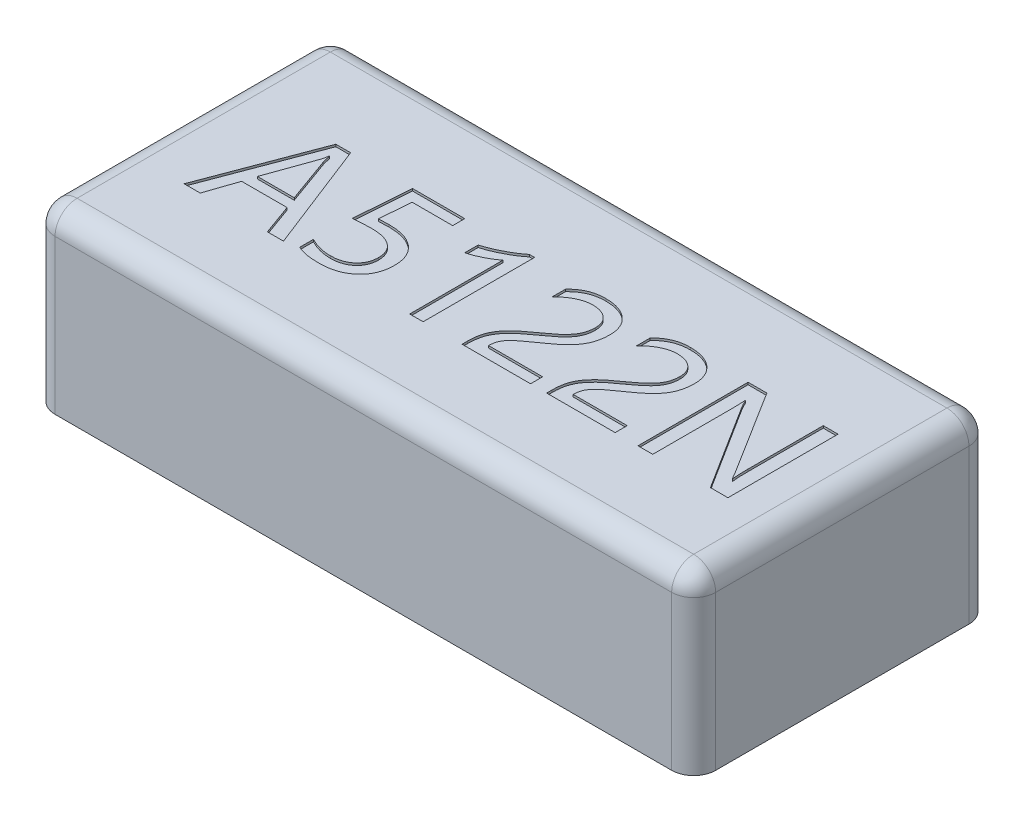
from build123d import *

# Parameters (mm, degrees)
SKETCH_1_W          = 3
SKETCH_1_H          = 1.35
EXTRUDE_1_DEPTH     = 0.8
CUT_EXTRUDE_1_DEPTH = 0.01
FILLET_1_R          = 0.1


with BuildPart() as part:
    # 草图1 → 凸台-拉伸1 (new body)
    with BuildSketch(Plane(origin=(0, 0, 0), x_dir=(1, 0, 0), z_dir=(0, 1, 0))):
        Rectangle(SKETCH_1_W, SKETCH_1_H)
    extrude(amount=EXTRUDE_1_DEPTH)

    # 草图2 → 切除-拉伸1 (cut)
    # profile 1 of 6: a face of its own
    with BuildSketch(Plane(origin=(0, 0.8, 0), x_dir=(1, 0, 0), z_dir=(0, 1, 0))):
        Polygon((-0.762682927, -0.275), (-0.835853659, -0.275), (-0.88644436, -0.134756098), (-1.092999238, -0.134756098), (-1.140731707, -0.275), (-1.213902439, -0.275), (-1.024878049, 0.225), (-0.957804878, 0.225), align=None)
        with BuildLine():
            Line((-0.908929116, -0.079878049), (-0.984195884, 0.128963415))
            add(Edge.make_bspline(
                [(-0.984195884, 0.128963415), (-0.984819837, 0.130958332), (-0.98624412, 0.135512088), (-0.988110524, 0.143371617), (-0.989940416, 0.153088443), (-0.991219762, 0.160180703), (-0.99191311, 0.16402439)],
                knots=[0, 0, 0, 0, 0.697926861, 1.593143037, 2.69559139, 4, 4, 4, 4], degree=3))
            Line((-0.99191311, 0.16402439), (-0.993532774, 0.16402439))
            add(Edge.make_bspline(
                [(-0.993532774, 0.16402439), (-0.994115816, 0.160463944), (-0.995217229, 0.153737965), (-0.997076473, 0.144313477), (-0.999146543, 0.136168571), (-1.000780111, 0.131242354), (-1.001535823, 0.128963415)],
                knots=[0, 0, 0, 0, 1.202164453, 2.270988586, 3.200134455, 4, 4, 4, 4], degree=3))
            Line((-1.001535823, 0.128963415), (-1.076135671, -0.079878049))
            Line((-1.076135671, -0.079878049), (-0.908929116, -0.079878049))
        make_face(mode=Mode.SUBTRACT)
    # profile 2 of 6: a face of its own
    with BuildSketch(Plane(origin=(0, 0.8, 0), x_dir=(1, 0, 0), z_dir=(0, 1, 0))):
        with BuildLine():
            add(Edge.make_bspline(
                [(-0.415121951, -0.119321646), (-0.415260902, -0.12523666), (-0.415533167, -0.136826739), (-0.417887924, -0.153767891), (-0.421638413, -0.169887983), (-0.427129507, -0.185060805), (-0.433988028, -0.199430346), (-0.442572039, -0.212776961), (-0.452492586, -0.225388943), (-0.464052036, -0.236834997), (-0.476798193, -0.247236482), (-0.490700249, -0.256310478), (-0.505598386, -0.264098094), (-0.521670586, -0.27027152), (-0.53873972, -0.275100097), (-0.556865546, -0.278637204), (-0.57602153, -0.280752417), (-0.589151083, -0.28098087), (-0.59585747, -0.281097561)],
                knots=[0, 0, 0, 0, 1.038164429, 2.034214658, 2.997233558, 3.939129121, 4.861930507, 5.787020473, 6.719742937, 7.673971107, 8.63719987, 9.603860661, 10.584050106, 11.583357422, 12.62125224, 13.695192892, 14.822737847, 16, 16, 16, 16], degree=3))
            add(Edge.make_bspline(
                [(-0.59585747, -0.281097561), (-0.601575406, -0.281054569), (-0.612670493, -0.280971146), (-0.62872232, -0.279994611), (-0.643663296, -0.278482416), (-0.657483785, -0.276450727), (-0.670177479, -0.273683171), (-0.681780763, -0.27036605), (-0.692282069, -0.26646385), (-0.698655053, -0.263152325), (-0.701707317, -0.261566311)],
                knots=[0, 0, 0, 0, 1.262385657, 2.449533769, 3.549188029, 4.577605264, 5.532151448, 6.415420393, 7.241084701, 8, 8, 8, 8], degree=3))
            Line((-0.701707317, -0.261566311), (-0.701707317, -0.200304878))
            add(Edge.make_bspline(
                [(-0.701707317, -0.200304878), (-0.697509039, -0.20239354), (-0.689190683, -0.206531958), (-0.676386069, -0.21169761), (-0.663604416, -0.216256725), (-0.650697436, -0.219841452), (-0.637763189, -0.222743267), (-0.624739759, -0.224705419), (-0.611668722, -0.226027811), (-0.602911029, -0.226155544), (-0.598525152, -0.226219512)],
                knots=[0, 0, 0, 0, 1.047486704, 2.075462357, 3.083249586, 4.078565337, 5.066949607, 6.043568961, 7.0202141, 8, 8, 8, 8], degree=3))
            add(Edge.make_bspline(
                [(-0.598525152, -0.226219512), (-0.594266917, -0.226114915), (-0.585954623, -0.225910735), (-0.573806645, -0.224702562), (-0.56228904, -0.222521759), (-0.551444415, -0.219341561), (-0.541132686, -0.215463568), (-0.531505843, -0.210580233), (-0.522495941, -0.204847636), (-0.514207141, -0.198257821), (-0.506692759, -0.190984798), (-0.500169614, -0.183004319), (-0.494609732, -0.174476512), (-0.489998836, -0.165387739), (-0.486453177, -0.155695759), (-0.484021656, -0.145427152), (-0.482425125, -0.134615588), (-0.482272873, -0.127203558), (-0.482195122, -0.123418445)],
                knots=[0, 0, 0, 0, 1.169775658, 2.283461802, 3.349348441, 4.384667205, 5.38427129, 6.371310876, 7.344138773, 8.31281178, 9.275179281, 10.21120959, 11.137925121, 12.066445516, 13.004790073, 13.965376693, 14.960975861, 16, 16, 16, 16], degree=3))
            add(Edge.make_bspline(
                [(-0.482195122, -0.123418445), (-0.482262482, -0.119631925), (-0.482393909, -0.112243979), (-0.484117988, -0.101531648), (-0.486619826, -0.091396463), (-0.490374159, -0.08198613), (-0.495068695, -0.073143415), (-0.500971484, -0.065070634), (-0.507711465, -0.057427834), (-0.515727897, -0.050712732), (-0.524545098, -0.044614168), (-0.534295824, -0.039337225), (-0.544858385, -0.034879063), (-0.556317161, -0.03126407), (-0.568608732, -0.028400605), (-0.581803478, -0.026468727), (-0.595831591, -0.02517393), (-0.60547706, -0.025059046), (-0.610434451, -0.025)],
                knots=[0, 0, 0, 0, 0.99272704, 1.936926984, 2.840561303, 3.727434335, 4.588876569, 5.460898877, 6.346203886, 7.256578408, 8.197535443, 9.156084033, 10.160775423, 11.20196967, 12.305862844, 13.469319152, 14.699329797, 16, 16, 16, 16], degree=3))
            add(Edge.make_bspline(
                [(-0.610434451, -0.025), (-0.618120539, -0.025060319), (-0.633083703, -0.025177747), (-0.654974106, -0.02593133), (-0.675690722, -0.027230365), (-0.689102517, -0.028551214), (-0.695609756, -0.029192073)],
                knots=[0, 0, 0, 0, 1.081060347, 2.104592606, 3.080371503, 4, 4, 4, 4], degree=3))
            Line((-0.695609756, -0.029192073), (-0.676935976, 0.225))
            Line((-0.676935976, 0.225), (-0.439512195, 0.225))
            Line((-0.439512195, 0.225), (-0.439512195, 0.170121951))
            Line((-0.439512195, 0.170121951), (-0.624058689, 0.170121951))
            Line((-0.624058689, 0.170121951), (-0.634634146, 0.027972561))
            Line((-0.634634146, 0.027972561), (-0.588330793, 0.029878049))
            add(Edge.make_bspline(
                [(-0.588330793, 0.029878049), (-0.581751376, 0.029793109), (-0.56894406, 0.029627767), (-0.550325441, 0.027632461), (-0.532764038, 0.024636841), (-0.516271992, 0.0203757), (-0.500844703, 0.014868525), (-0.486581812, 0.00804022), (-0.473289788, 0.000141922), (-0.461244435, -0.009135445), (-0.450280795, -0.01936476), (-0.440966724, -0.030839481), (-0.432811804, -0.043073859), (-0.426336299, -0.056462802), (-0.421292946, -0.07081891), (-0.417662639, -0.086142271), (-0.415585268, -0.102432782), (-0.415278934, -0.113599286), (-0.415121951, -0.119321646)],
                knots=[0, 0, 0, 0, 1.218679116, 2.372248176, 3.465519652, 4.517479775, 5.524548886, 6.495855075, 7.443537969, 8.383975825, 9.308106099, 10.215311382, 11.116292035, 12.026926498, 12.963138392, 13.930908325, 14.939678235, 16, 16, 16, 16], degree=3))
        make_face()
    # profile 3 of 6: a face of its own
    with BuildSketch(Plane(origin=(0, 0.8, 0), x_dir=(1, 0, 0), z_dir=(0, 1, 0))):
        with BuildLine():
            Line((-0.189512195, -0.275), (-0.189512195, 0.149733232))
            add(Edge.make_bspline(
                [(-0.189512195, 0.149733232), (-0.192346519, 0.14712321), (-0.198588169, 0.14137551), (-0.210149791, 0.133606387), (-0.223947541, 0.124935408), (-0.239939412, 0.116417664), (-0.256729311, 0.10805238), (-0.273528408, 0.101103717), (-0.289536436, 0.095074127), (-0.30019508, 0.0922323), (-0.305365854, 0.090853659)],
                knots=[0, 0, 0, 0, 0.704945565, 1.552406624, 2.545318557, 3.69082532, 4.869537831, 5.980344412, 7.020214797, 8, 8, 8, 8], degree=3))
            Line((-0.305365854, 0.090853659), (-0.305365854, 0.151829268))
            add(Edge.make_bspline(
                [(-0.305365854, 0.151829268), (-0.298631014, 0.153793347), (-0.284809115, 0.157824223), (-0.264160875, 0.165990134), (-0.242663796, 0.175200882), (-0.221212827, 0.186134718), (-0.200625716, 0.197470264), (-0.182063996, 0.208807994), (-0.166043289, 0.219751609), (-0.156657746, 0.227477429), (-0.152259909, 0.231097561)],
                knots=[0, 0, 0, 0, 0.96993373, 1.990593425, 3.068734014, 4.204309626, 5.319269746, 6.319096776, 7.212369491, 8, 8, 8, 8], degree=3))
            Line((-0.152259909, 0.231097561), (-0.128536585, 0.231097561))
            Line((-0.128536585, 0.231097561), (-0.128536585, -0.275))
            Line((-0.128536585, -0.275), (-0.189512195, -0.275))
        make_face()
    # profile 4 of 6: a face of its own
    with BuildSketch(Plane(origin=(0, 0.8, 0), x_dir=(1, 0, 0), z_dir=(0, 1, 0))):
        with BuildLine():
            add(Edge.make_bspline(
                [(0.286097561, 0.092282774), (0.286037108, 0.095463368), (0.285918736, 0.101691249), (0.28462195, 0.110744613), (0.282682168, 0.119295031), (0.279761029, 0.12725745), (0.276150535, 0.134766761), (0.27164437, 0.141719481), (0.266377784, 0.148184135), (0.260235673, 0.153962471), (0.253477506, 0.159203928), (0.24612347, 0.163811235), (0.238144734, 0.167614569), (0.22962738, 0.170755423), (0.22052128, 0.17327107), (0.210814324, 0.174909842), (0.200534072, 0.176001632), (0.193493865, 0.176145478), (0.189870427, 0.176219512)],
                knots=[0, 0, 0, 0, 1.056493516, 2.068706555, 3.034034235, 3.965700842, 4.881624935, 5.798157171, 6.713229185, 7.646568874, 8.594657173, 9.55250989, 10.525140525, 11.527173638, 12.566921247, 13.660321224, 14.795819181, 16, 16, 16, 16], degree=3))
            add(Edge.make_bspline(
                [(0.189870427, 0.176219512), (0.184616762, 0.176039497), (0.173996066, 0.175675581), (0.158069922, 0.172551806), (0.142065962, 0.16756762), (0.126150901, 0.160563739), (0.110403467, 0.151898546), (0.095136208, 0.141455531), (0.08036348, 0.129310796), (0.071239984, 0.120122254), (0.066585366, 0.115434451)],
                knots=[0, 0, 0, 0, 0.892438729, 1.804135133, 2.748433758, 3.73736023, 4.75466059, 5.799871438, 6.877540064, 8, 8, 8, 8], degree=3))
            Line((0.066585366, 0.115434451), (0.066585366, 0.17660061))
            add(Edge.make_bspline(
                [(0.066585366, 0.17660061), (0.070769002, 0.180805496), (0.07904729, 0.189125832), (0.092603047, 0.200156156), (0.1071503, 0.209408862), (0.122490072, 0.217354479), (0.138997503, 0.223606342), (0.15681926, 0.227935202), (0.175938928, 0.23067075), (0.189162004, 0.230952528), (0.195967988, 0.231097561)],
                knots=[0, 0, 0, 0, 0.983052709, 1.945195957, 2.890199405, 3.836873689, 4.805049423, 5.808824637, 6.872191052, 8, 8, 8, 8], degree=3))
            add(Edge.make_bspline(
                [(0.195967988, 0.231097561), (0.201499169, 0.230995753), (0.212335004, 0.230796307), (0.228154002, 0.229003513), (0.243198533, 0.226346932), (0.257325158, 0.222274315), (0.270707857, 0.217264487), (0.283179808, 0.210926705), (0.294898473, 0.203584012), (0.305646308, 0.195102514), (0.315355283, 0.185688305), (0.32393213, 0.175457525), (0.331104645, 0.164339631), (0.33692842, 0.152425522), (0.341559639, 0.139761646), (0.344758841, 0.126268084), (0.34669202, 0.111965417), (0.346943992, 0.102165775), (0.347073171, 0.097141768)],
                knots=[0, 0, 0, 0, 1.165659335, 2.283579358, 3.352509362, 4.382528111, 5.378518292, 6.360617159, 7.326516104, 8.289556701, 9.241242913, 10.173056761, 11.097893164, 12.023117237, 12.96350264, 13.934585421, 14.941118791, 16, 16, 16, 16], degree=3))
            add(Edge.make_bspline(
                [(0.347073171, 0.097141768), (0.347012737, 0.092628655), (0.346893336, 0.083711887), (0.345566227, 0.070613406), (0.343723241, 0.057930926), (0.340961669, 0.045728025), (0.337320342, 0.033990744), (0.332937578, 0.02271412), (0.327779579, 0.011917363), (0.321802722, 0.001495633), (0.314834232, -0.008706588), (0.306830072, -0.018906808), (0.297611735, -0.029070104), (0.287395012, -0.039425599), (0.275968592, -0.049745769), (0.263433793, -0.060113054), (0.249913676, -0.070679642), (0.240272886, -0.077383942), (0.235316311, -0.080830793)],
                knots=[0, 0, 0, 0, 0.982770191, 1.941704783, 2.86532617, 3.773295145, 4.663914152, 5.540094637, 6.406524984, 7.268052773, 8.154551202, 9.09565156, 10.090161433, 11.141928465, 12.263462189, 13.442437348, 14.685092139, 16, 16, 16, 16], degree=3))
            add(Edge.make_bspline(
                [(0.235316311, -0.080830793), (0.230321866, -0.084280407), (0.220716138, -0.09091499), (0.207067603, -0.100625895), (0.194650401, -0.10947442), (0.183544449, -0.117577001), (0.173790909, -0.125025081), (0.16518635, -0.13155201), (0.157933782, -0.137354734), (0.150199576, -0.143939067), (0.142123251, -0.151610714), (0.133857616, -0.160626609), (0.127200543, -0.169504376), (0.12205617, -0.178379998), (0.118361419, -0.187669224), (0.115662814, -0.197630819), (0.114194231, -0.20858234), (0.113961974, -0.216179859), (0.113841463, -0.220121951)],
                knots=[0, 0, 0, 0, 1.505881014, 2.896234166, 4.155602516, 5.288659075, 6.306624478, 7.200142241, 7.96796157, 8.610611676, 9.719635667, 10.729273515, 11.641662871, 12.467445708, 13.266290447, 14.114874402, 15.021872832, 16, 16, 16, 16], degree=3))
            Line((0.113841463, -0.220121951), (0.359268293, -0.220121951))
            Line((0.359268293, -0.220121951), (0.359268293, -0.275))
            Line((0.359268293, -0.275), (0.048292683, -0.275))
            Line((0.048292683, -0.275), (0.048292683, -0.250228659))
            add(Edge.make_bspline(
                [(0.048292683, -0.250228659), (0.048438829, -0.243331582), (0.048721135, -0.230008645), (0.050876321, -0.210832743), (0.054575045, -0.193281147), (0.059752232, -0.177109003), (0.066831981, -0.161893424), (0.075749465, -0.1471639), (0.086493429, -0.132557454), (0.097087265, -0.120814422), (0.106560022, -0.111111912), (0.114907478, -0.103577592), (0.124054991, -0.095497593), (0.134262682, -0.0871993), (0.145291811, -0.078393143), (0.157352873, -0.069335356), (0.170379333, -0.059951814), (0.179415318, -0.053604643), (0.184058689, -0.050342988)],
                knots=[0, 0, 0, 0, 1.301735404, 2.514534667, 3.636202092, 4.682652211, 5.712626133, 6.796226652, 7.928068212, 9.129839025, 9.778404403, 10.486922114, 11.251617588, 12.082117295, 12.969658096, 13.915626098, 14.928891403, 16, 16, 16, 16], degree=3))
            add(Edge.make_bspline(
                [(0.184058689, -0.050342988), (0.18881472, -0.047009549), (0.198008011, -0.040566094), (0.210937368, -0.030695385), (0.222846954, -0.021305233), (0.23342433, -0.012073149), (0.242993382, -0.003306745), (0.251240737, 0.005268447), (0.258456049, 0.013455909), (0.264574574, 0.021456347), (0.269702837, 0.029506336), (0.274081285, 0.037700277), (0.277822451, 0.046132235), (0.280915994, 0.05481301), (0.283136821, 0.063829949), (0.284923032, 0.073072564), (0.285826313, 0.082610578), (0.286006676, 0.089041992), (0.286097561, 0.092282774)],
                knots=[0, 0, 0, 0, 1.519141936, 2.93646385, 4.254680188, 5.48560532, 6.608384985, 7.648317938, 8.596314735, 9.461999189, 10.280135729, 11.09038868, 11.890052435, 12.691440534, 13.497423121, 14.317034656, 15.151955661, 16, 16, 16, 16], degree=3))
        make_face()
    # profile 5 of 6: a face of its own
    with BuildSketch(Plane(origin=(0, 0.8, 0), x_dir=(1, 0, 0), z_dir=(0, 1, 0))):
        with BuildLine():
            add(Edge.make_bspline(
                [(0.670243902, 0.092282774), (0.67018345, 0.095463368), (0.670065078, 0.101691249), (0.668768291, 0.110744613), (0.666828509, 0.119295031), (0.66390737, 0.12725745), (0.660296877, 0.134766761), (0.655790712, 0.141719481), (0.650524126, 0.148184135), (0.644382015, 0.153962471), (0.637623848, 0.159203928), (0.630269812, 0.163811235), (0.622291076, 0.167614569), (0.613773722, 0.170755423), (0.604667621, 0.17327107), (0.594960666, 0.174909842), (0.584680414, 0.176001632), (0.577640207, 0.176145478), (0.574016768, 0.176219512)],
                knots=[0, 0, 0, 0, 1.056493516, 2.068706555, 3.034034235, 3.965700842, 4.881624935, 5.798157171, 6.713229185, 7.646568874, 8.594657173, 9.55250989, 10.525140525, 11.527173638, 12.566921247, 13.660321224, 14.795819181, 16, 16, 16, 16], degree=3))
            add(Edge.make_bspline(
                [(0.574016768, 0.176219512), (0.568763104, 0.176039497), (0.558142408, 0.175675581), (0.542216263, 0.172551806), (0.526212303, 0.16756762), (0.510297243, 0.160563739), (0.494549808, 0.151898546), (0.47928255, 0.141455531), (0.464509821, 0.129310796), (0.455386326, 0.120122254), (0.450731707, 0.115434451)],
                knots=[0, 0, 0, 0, 0.892438729, 1.804135133, 2.748433758, 3.73736023, 4.75466059, 5.799871438, 6.877540064, 8, 8, 8, 8], degree=3))
            Line((0.450731707, 0.115434451), (0.450731707, 0.17660061))
            add(Edge.make_bspline(
                [(0.450731707, 0.17660061), (0.454915344, 0.180805496), (0.463193631, 0.189125832), (0.476749389, 0.200156156), (0.491296642, 0.209408862), (0.506636413, 0.217354479), (0.523143845, 0.223606342), (0.540965602, 0.227935202), (0.560085269, 0.23067075), (0.573308346, 0.230952528), (0.580114329, 0.231097561)],
                knots=[0, 0, 0, 0, 0.983052709, 1.945195957, 2.890199405, 3.836873689, 4.805049423, 5.808824637, 6.872191052, 8, 8, 8, 8], degree=3))
            add(Edge.make_bspline(
                [(0.580114329, 0.231097561), (0.585645511, 0.230995753), (0.596481346, 0.230796307), (0.612300343, 0.229003513), (0.627344875, 0.226346932), (0.6414715, 0.222274315), (0.654854199, 0.217264487), (0.667326149, 0.210926705), (0.679044814, 0.203584012), (0.689792649, 0.195102514), (0.699501624, 0.185688305), (0.708078472, 0.175457525), (0.715250986, 0.164339631), (0.721074762, 0.152425522), (0.725705981, 0.139761646), (0.728905182, 0.126268084), (0.730838361, 0.111965417), (0.731090333, 0.102165775), (0.731219512, 0.097141768)],
                knots=[0, 0, 0, 0, 1.165659335, 2.283579358, 3.352509362, 4.382528111, 5.378518292, 6.360617159, 7.326516104, 8.289556701, 9.241242913, 10.173056761, 11.097893164, 12.023117237, 12.96350264, 13.934585421, 14.941118791, 16, 16, 16, 16], degree=3))
            add(Edge.make_bspline(
                [(0.731219512, 0.097141768), (0.731159079, 0.092628655), (0.731039677, 0.083711887), (0.729712568, 0.070613406), (0.727869583, 0.057930926), (0.725108011, 0.045728025), (0.721466683, 0.033990744), (0.717083919, 0.02271412), (0.711925921, 0.011917363), (0.705949064, 0.001495633), (0.698980573, -0.008706588), (0.690976414, -0.018906808), (0.681758077, -0.029070104), (0.671541353, -0.039425599), (0.660114934, -0.049745769), (0.647580134, -0.060113054), (0.634060017, -0.070679642), (0.624419227, -0.077383942), (0.619462652, -0.080830793)],
                knots=[0, 0, 0, 0, 0.982770191, 1.941704783, 2.86532617, 3.773295145, 4.663914152, 5.540094637, 6.406524984, 7.268052773, 8.154551202, 9.09565156, 10.090161433, 11.141928465, 12.263462189, 13.442437348, 14.685092139, 16, 16, 16, 16], degree=3))
            add(Edge.make_bspline(
                [(0.619462652, -0.080830793), (0.614468207, -0.084280407), (0.60486248, -0.09091499), (0.591213944, -0.100625895), (0.578796743, -0.10947442), (0.56769079, -0.117577001), (0.557937251, -0.125025081), (0.549332691, -0.13155201), (0.542080123, -0.137354734), (0.534345917, -0.143939067), (0.526269592, -0.151610714), (0.518003957, -0.160626609), (0.511346885, -0.169504376), (0.506202511, -0.178379998), (0.502507761, -0.187669224), (0.499809155, -0.197630819), (0.498340572, -0.20858234), (0.498108315, -0.216179859), (0.497987805, -0.220121951)],
                knots=[0, 0, 0, 0, 1.505881014, 2.896234166, 4.155602516, 5.288659075, 6.306624478, 7.200142241, 7.96796157, 8.610611676, 9.719635667, 10.729273515, 11.641662871, 12.467445708, 13.266290447, 14.114874402, 15.021872832, 16, 16, 16, 16], degree=3))
            Line((0.497987805, -0.220121951), (0.743414634, -0.220121951))
            Line((0.743414634, -0.220121951), (0.743414634, -0.275))
            Line((0.743414634, -0.275), (0.432439024, -0.275))
            Line((0.432439024, -0.275), (0.432439024, -0.250228659))
            add(Edge.make_bspline(
                [(0.432439024, -0.250228659), (0.43258517, -0.243331582), (0.432867477, -0.230008645), (0.435022663, -0.210832743), (0.438721387, -0.193281147), (0.443898573, -0.177109003), (0.450978323, -0.161893424), (0.459895806, -0.1471639), (0.470639771, -0.132557454), (0.481233606, -0.120814422), (0.490706363, -0.111111912), (0.499053819, -0.103577592), (0.508201332, -0.095497593), (0.518409024, -0.0871993), (0.529438153, -0.078393143), (0.541499214, -0.069335356), (0.554525674, -0.059951814), (0.563561659, -0.053604643), (0.56820503, -0.050342988)],
                knots=[0, 0, 0, 0, 1.301735404, 2.514534667, 3.636202092, 4.682652211, 5.712626133, 6.796226652, 7.928068212, 9.129839025, 9.778404403, 10.486922114, 11.251617588, 12.082117295, 12.969658096, 13.915626098, 14.928891403, 16, 16, 16, 16], degree=3))
            add(Edge.make_bspline(
                [(0.56820503, -0.050342988), (0.572961062, -0.047009549), (0.582154352, -0.040566094), (0.595083709, -0.030695385), (0.606993295, -0.021305233), (0.617570671, -0.012073149), (0.627139724, -0.003306745), (0.635387079, 0.005268447), (0.642602391, 0.013455909), (0.648720916, 0.021456347), (0.653849179, 0.029506336), (0.658227627, 0.037700277), (0.661968793, 0.046132235), (0.665062335, 0.05481301), (0.667283163, 0.063829949), (0.669069374, 0.073072564), (0.669972655, 0.082610578), (0.670153018, 0.089041992), (0.670243902, 0.092282774)],
                knots=[0, 0, 0, 0, 1.519141936, 2.93646385, 4.254680188, 5.48560532, 6.608384985, 7.648317938, 8.596314735, 9.461999189, 10.280135729, 11.09038868, 11.890052435, 12.691440534, 13.497423121, 14.317034656, 15.151955661, 16, 16, 16, 16], degree=3))
        make_face()
    # profile 6 of 6: a face of its own
    with BuildSketch(Plane(origin=(0, 0.8, 0), x_dir=(1, 0, 0), z_dir=(0, 1, 0))):
        with BuildLine():
            Line((1.255609756, -0.275), (1.17605564, -0.275))
            Line((1.17605564, -0.275), (0.93081936, 0.113147866))
            add(Edge.make_bspline(
                [(0.93081936, 0.113147866), (0.927573642, 0.118542223), (0.921268042, 0.12902208), (0.916473137, 0.140272352), (0.914146341, 0.145731707)],
                knots=[0, 0, 0, 0, 1.029471514, 2, 2, 2, 2], degree=3))
            Line((0.914146341, 0.145731707), (0.912145579, 0.145731707))
            add(Edge.make_bspline(
                [(0.912145579, 0.145731707), (0.912317186, 0.144144865), (0.912700968, 0.140596034), (0.913018731, 0.134680414), (0.913432737, 0.127665193), (0.91370435, 0.119501039), (0.913860455, 0.110194401), (0.914081684, 0.099746809), (0.914165254, 0.088154339), (0.914152856, 0.080055891), (0.914146341, 0.075800305)],
                knots=[0, 0, 0, 0, 0.547243266, 1.223861017, 2.030938069, 2.957211031, 4.024706972, 5.222865249, 6.540666563, 8, 8, 8, 8], degree=3))
            Line((0.914146341, 0.075800305), (0.914146341, -0.275))
            Line((0.914146341, -0.275), (0.847073171, -0.275))
            Line((0.847073171, -0.275), (0.847073171, 0.225))
            Line((0.847073171, 0.225), (0.932439024, 0.225))
            Line((0.932439024, 0.225), (1.170339177, -0.155240091))
            add(Edge.make_bspline(
                [(1.170339177, -0.155240091), (1.171669756, -0.157401673), (1.174196781, -0.161506932), (1.17782739, -0.167292642), (1.181013961, -0.172495), (1.183739635, -0.177103702), (1.186039055, -0.181099001), (1.187863606, -0.18447551), (1.189311428, -0.187230243), (1.19009743, -0.188901388), (1.190442073, -0.189634146)],
                knots=[0, 0, 0, 0, 1.528350138, 2.902631225, 4.112788085, 5.201585076, 6.126599139, 6.888137874, 7.512474782, 8, 8, 8, 8], degree=3))
            Line((1.190442073, -0.189634146), (1.191775915, -0.189634146))
            add(Edge.make_bspline(
                [(1.191775915, -0.189634146), (1.191507602, -0.18773034), (1.190923046, -0.183582632), (1.190309173, -0.176873203), (1.189693018, -0.169190508), (1.189397966, -0.160574942), (1.188975511, -0.151018927), (1.188675085, -0.140537896), (1.188641435, -0.129103004), (1.188572455, -0.121163561), (1.188536585, -0.117035061)],
                knots=[0, 0, 0, 0, 0.634399717, 1.382128569, 2.222929659, 3.177583211, 4.226479155, 5.379771441, 6.637484509, 8, 8, 8, 8], degree=3))
            Line((1.188536585, -0.117035061), (1.188536585, 0.225))
            Line((1.188536585, 0.225), (1.255609756, 0.225))
            Line((1.255609756, 0.225), (1.255609756, -0.275))
        make_face()
    extrude(amount=-CUT_EXTRUDE_1_DEPTH, mode=Mode.SUBTRACT)

    # 圆角1
    fillet_1_edges = [part.edges().sort_by_distance(p)[0] for p in [
        (-1.5, 0.8, 0),
        (0, 0.8, 0.675),
        (1.5, 0.8, 0),
        (0, 0.8, -0.675),
        (1.5, 0.4, 0.675),
        (-1.5, 0.4, 0.675),
        (-1.5, 0.4, -0.675),
        (1.5, 0.4, -0.675),
    ]]
    fillet(fillet_1_edges, radius=FILLET_1_R)


solid = part.part
